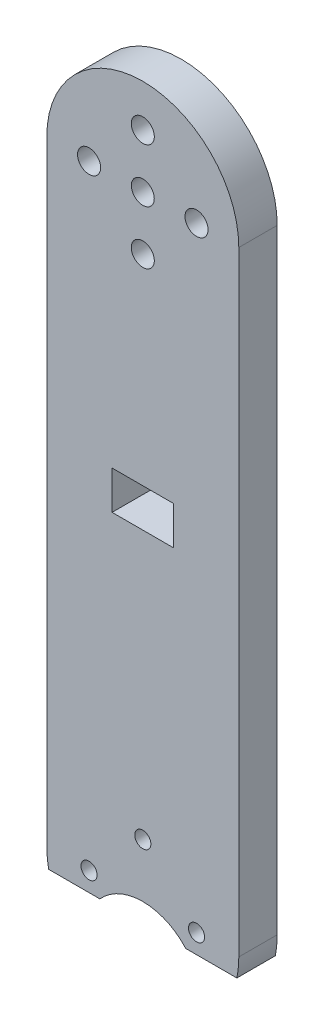
from build123d import *

# Parameters (mm, degrees)
SKETCH1_R           = 1.5
SKETCH1_R_2         = 1.493875789
SKETCH1_R_3         = 1.05
BOSS_EXTRUDE1_DEPTH = 5
SKETCH3_W           = 8
SKETCH3_H           = 5
CUT_EXTRUDE3_DEPTH  = 10
SKETCH5_R           = 7.5
SKETCH5_W           = 24.494897428
SKETCH5_H           = 10
CUT_EXTRUDE4_DEPTH  = 10


with BuildPart() as part:
    # Sketch1 → Boss-Extrude1 (new body)
    with BuildSketch(Plane.XY):
        with BuildLine():
            Line((-12.5, 0), (-12.5, -80))
            ThreePointArc((-12.5, -80), (0, -92.5), (12.5, -80))
            Line((12.5, -80), (12.5, 0))
            ThreePointArc((12.5, 0), (0, 12.5), (-12.5, 0))
        make_face()
        with Locations((0, 6.993875789)):
            Circle(SKETCH1_R, mode=Mode.SUBTRACT)
        Circle(SKETCH1_R_2, mode=Mode.SUBTRACT)
        with Locations((-7, -80)):
            Circle(SKETCH1_R_3, mode=Mode.SUBTRACT)
        with Locations((0, -73)):
            Circle(SKETCH1_R_3, mode=Mode.SUBTRACT)
        with Locations((7, -80)):
            Circle(SKETCH1_R_3, mode=Mode.SUBTRACT)
        with Locations((-6.993875789, 0)):
            Circle(SKETCH1_R, mode=Mode.SUBTRACT)
        with Locations((0, -6.993875789)):
            Circle(SKETCH1_R, mode=Mode.SUBTRACT)
        with Locations((6.993875789, 0)):
            Circle(SKETCH1_R, mode=Mode.SUBTRACT)
    extrude(amount=BOSS_EXTRUDE1_DEPTH)

    # Sketch3 → Cut-Extrude3 (cut)
    with BuildSketch(Plane.XY.offset(5)):
        with Locations((0, -35.613875789)):
            Rectangle(SKETCH3_W, SKETCH3_H)
    extrude(amount=-CUT_EXTRUDE3_DEPTH, mode=Mode.SUBTRACT)

    # Sketch5 → Cut-Extrude4 (cut)
    with BuildSketch(Plane.XY.offset(5)):
        with Locations((0, -87.5)):
            Circle(SKETCH5_R)
        with Locations((0, -87.5)):
            Rectangle(SKETCH5_W, SKETCH5_H)
    extrude(amount=-CUT_EXTRUDE4_DEPTH, mode=Mode.SUBTRACT)


solid = part.part
